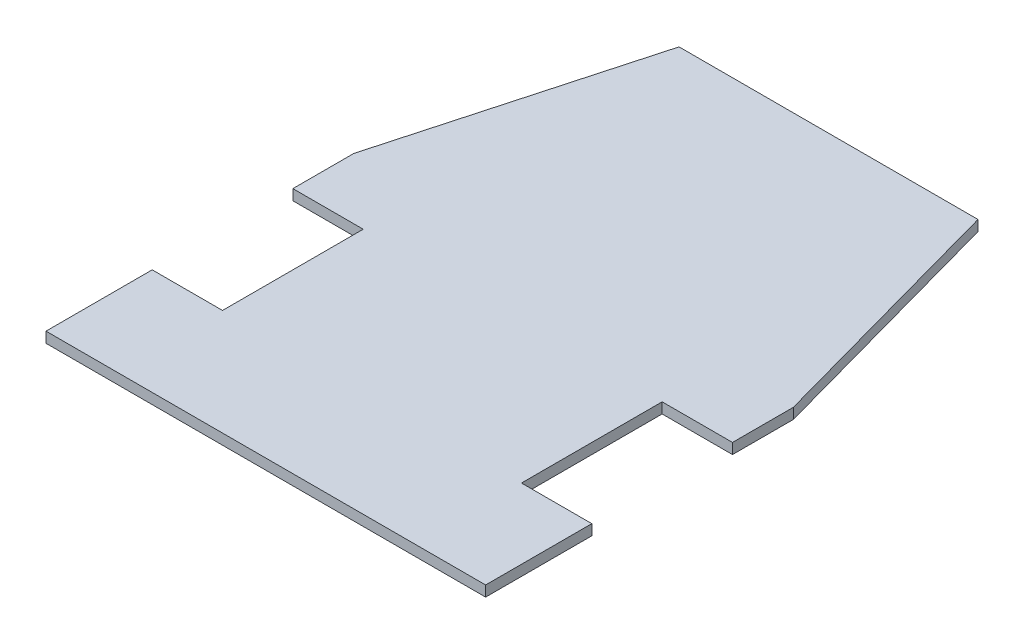
from build123d import *

# Parameters (mm, degrees)
BOSS_EXTRUDE1_DEPTH = 6


with BuildPart() as part:
    # Sketch1 → Boss-Extrude1 (new body)
    with BuildSketch(Plane(origin=(0, 0, 0), x_dir=(1, 0, 0), z_dir=(0, 1, 0))):
        Polygon((0, 0), (0, 60.388920467), (40, 60.388920467), (40, 140.388920467), (0, 140.388920467), (0, 175), (40, 320), (210, 320), (250, 175), (250, 140.388920467), (210, 140.388920467), (210, 60.388920467), (250, 60.388920467), (250, 0), align=None)
    extrude(amount=BOSS_EXTRUDE1_DEPTH)


solid = part.part
